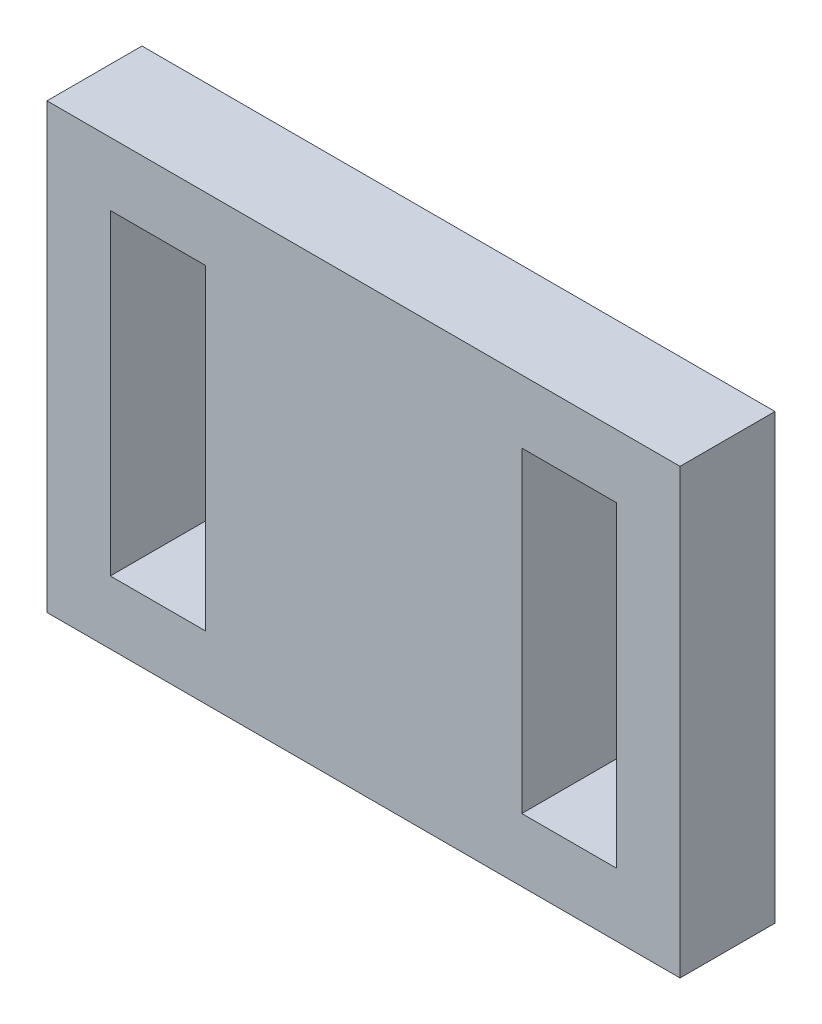
from build123d import *

# Parameters (mm, degrees)
SKETCH_1_W      = 20
SKETCH_1_H      = 14
SKETCH_1_W_2    = 3
SKETCH_1_H_2    = 10
EXTRUDE_1_DEPTH = 3


with BuildPart() as part:
    # 草图1 → 凸台-拉伸1 (new body)
    with BuildSketch(Plane.XY):
        Rectangle(SKETCH_1_W, SKETCH_1_H)
        with Locations((6.5, 0)):
            Rectangle(SKETCH_1_W_2, SKETCH_1_H_2, mode=Mode.SUBTRACT)
        with Locations((-6.5, 0)):
            Rectangle(SKETCH_1_W_2, SKETCH_1_H_2, mode=Mode.SUBTRACT)
    extrude(amount=EXTRUDE_1_DEPTH)


solid = part.part
